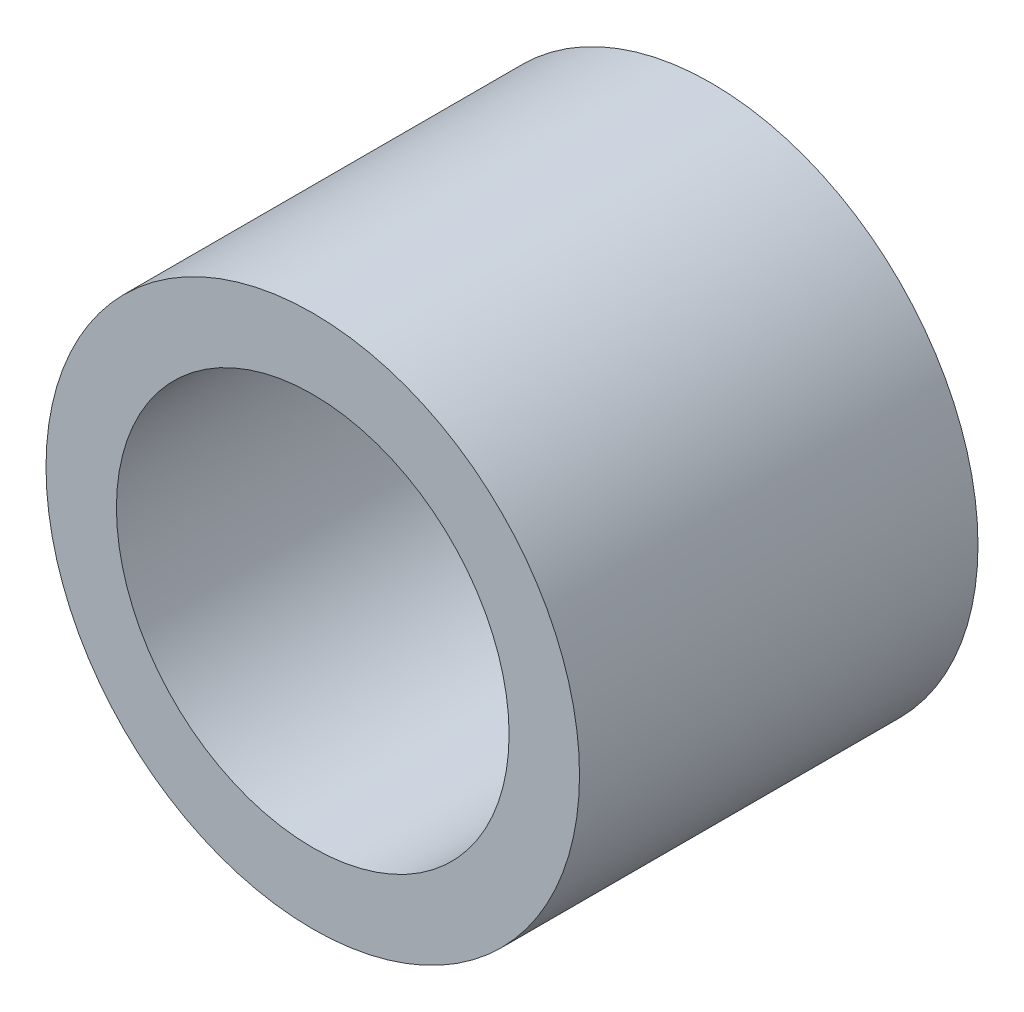
from build123d import *

# Parameters (mm, degrees)
SKETCH1_R           = 5.55625
SKETCH1_R_2         = 4.0894
BOSS_EXTRUDE1_DEPTH = 8.3


with BuildPart() as part:
    # Sketch1 → Boss-Extrude1 (new body)
    with BuildSketch(Plane.XY):
        Circle(SKETCH1_R)
        Circle(SKETCH1_R_2, mode=Mode.SUBTRACT)
    extrude(amount=BOSS_EXTRUDE1_DEPTH)


solid = part.part
